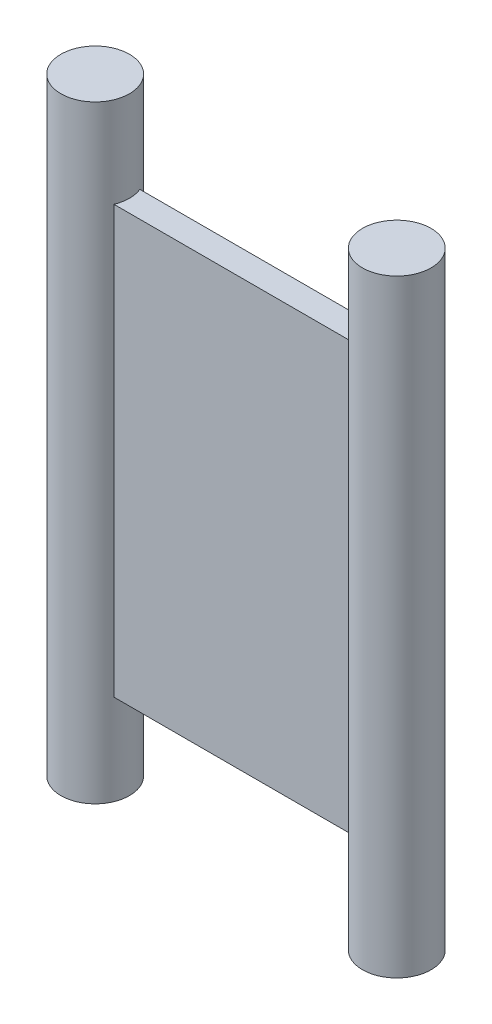
from build123d import *

# Parameters (mm, degrees)
SKETCH1_W           = 11.66
SKETCH1_H           = 1
BOSS_EXTRUDE1_DEPTH = 16.5
SKETCH2_R           = 1.325
BOSS_EXTRUDE2_DEPTH = 11.75


with BuildPart() as part:
    # Sketch1 → Boss-Extrude1 (new body)
    with BuildSketch(Plane(origin=(0, 0, 0), x_dir=(1, 0, 0), z_dir=(0, 1, 0))):
        Rectangle(SKETCH1_W, SKETCH1_H)
    extrude(amount=BOSS_EXTRUDE1_DEPTH)

    # Sketch2 → Boss-Extrude2 (add, symmetric)
    with BuildSketch(Plane(origin=(0, 8.25, 0), x_dir=(1, 0, 0), z_dir=(0, 1, 0))):
        with Locations(Location((-5.83, 0, 0), (0, 0, 270))):
            Circle(SKETCH2_R)
        with Locations(Location((5.83, 0, 0), (0, 0, 270))):
            Circle(SKETCH2_R)
    extrude(amount=BOSS_EXTRUDE2_DEPTH, both=True)


solid = part.part
